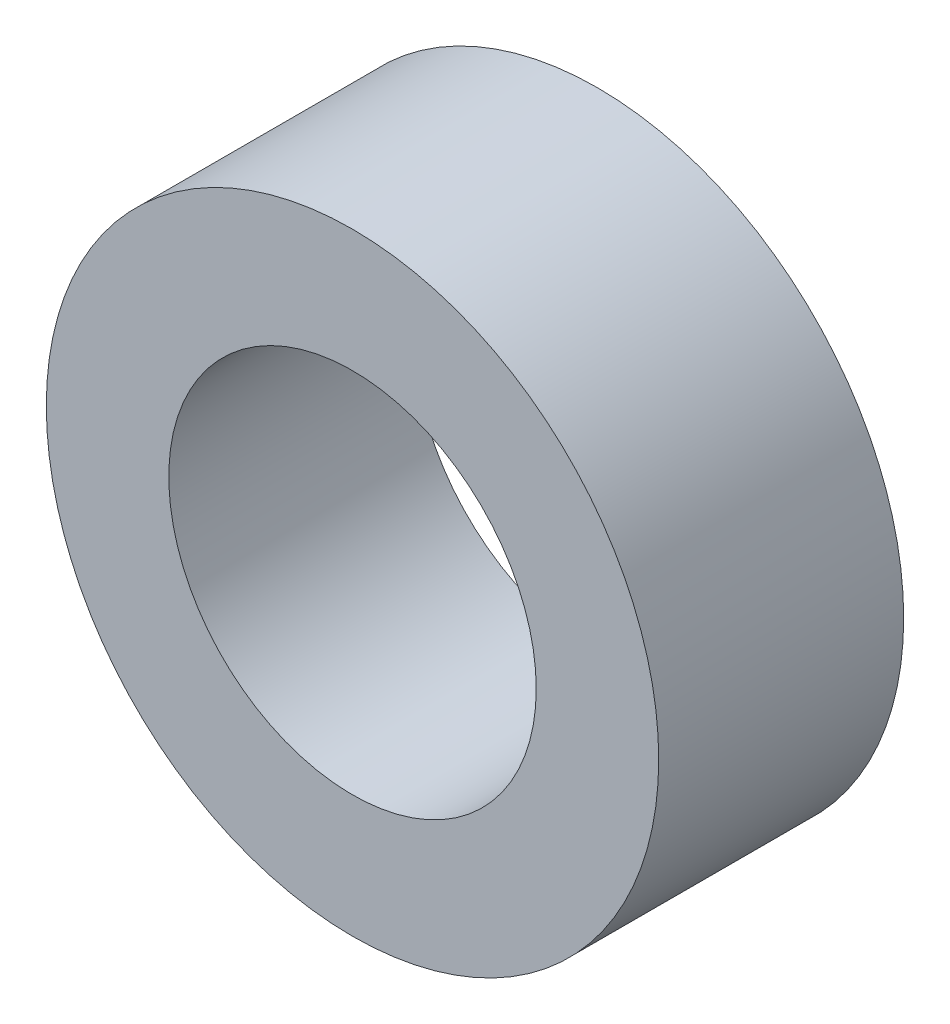
from build123d import *

# Parameters (mm, degrees)
SKIZZE1_R                       = 2.5
SKIZZE1_R_2                     = 1.5
AUFSATZ_LINEAR_AUSTRAGEN1_DEPTH = 2


with BuildPart() as part:
    # Skizze1 → Aufsatz-Linear austragen1 (new body)
    with BuildSketch(Plane.XY):
        with Locations((-1.222189108, 0.819515211)):
            Circle(SKIZZE1_R)
        with Locations((-1.222189108, 0.819515211)):
            Circle(SKIZZE1_R_2, mode=Mode.SUBTRACT)
    extrude(amount=AUFSATZ_LINEAR_AUSTRAGEN1_DEPTH)


solid = part.part
